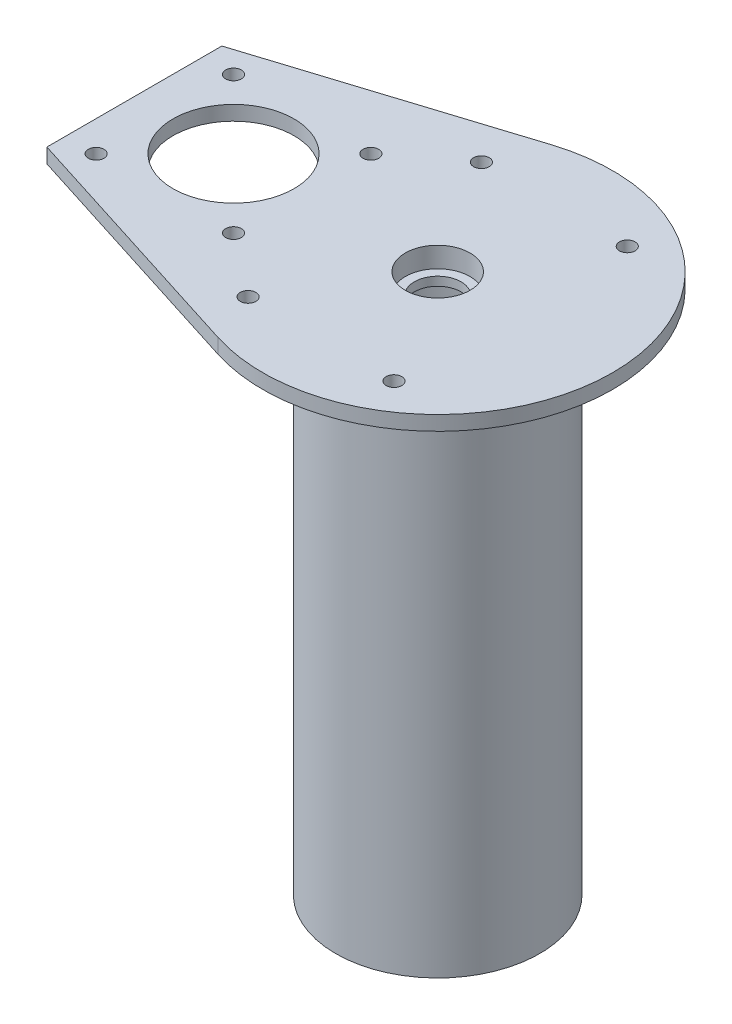
from build123d import *
from build123d.topology import SkipClean

# Parameters (mm, degrees)
SKETCH2_R           = 2.685
SKETCH2_R_2         = 11.1
SKETCH2_R_3         = 20.75
BOSS_EXTRUDE1_DEPTH = 5
SKETCH3_R           = 35
SKETCH3_R_2         = 30
BOSS_EXTRUDE2_DEPTH = 175
SKETCH4_R           = 35
BOSS_EXTRUDE3_DEPTH = 5
CUT_EXTRUDE3_START  = -6
CUT_EXTRUDE3_DEPTH  = 6
SKETCH10_R          = 16.1
BOSS_EXTRUDE5_DEPTH = 5
SKETCH5_R           = 11.1
CUT_EXTRUDE7_DEPTH  = 7
CUT_EXTRUDE8_REACH  = 216.709
SKETCH11_R          = 8
BOSS_EXTRUDE6_START = 2
SKETCH13_R          = 16.1
SKETCH13_R_2        = 11.1
BOSS_EXTRUDE6_DEPTH = 2
BOSS_EXTRUDE7_START = 3
SKETCH14_R          = 16.1
SKETCH14_R_2        = 8
BOSS_EXTRUDE7_DEPTH = 3
SKETCH15_R          = 2.685
CUT_EXTRUDE9_DEPTH  = 221.547047


with BuildPart() as part:
    # Sketch2 → Boss-Extrude1 (new body)
    with BuildSketch(Plane(origin=(0, 0, 0), x_dir=(1, 0, 0), z_dir=(0, 1, 0))):
        with BuildLine():
            Line((-104, -30), (-18.115404, -57.199931))
            ThreePointArc((-18.115404, -57.199931), (60, 0), (-18.115404, 57.199931))
            Line((-18.115404, 57.199931), (-104, 30))
            Line((-104, 30), (-104, -30))
        make_face()
        with Locations(Location((-93.55, 23.55, 0), (0, 0, 270))):
            Circle(SKETCH2_R, mode=Mode.SUBTRACT)
        with Locations(Location((-46.45, 23.55, 0), (0, 0, 270))):
            Circle(SKETCH2_R, mode=Mode.SUBTRACT)
        with Locations(Location((-93.55, -23.55, 0), (0, 0, 270))):
            Circle(SKETCH2_R, mode=Mode.SUBTRACT)
        with Locations(Location((-46.45, -23.55, 0), (0, 0, 270))):
            Circle(SKETCH2_R, mode=Mode.SUBTRACT)
        with Locations(Location((0, 0, 0), (0, 0, 270))):
            Circle(SKETCH2_R_2, mode=Mode.SUBTRACT)
        with Locations(Location((-70, 0, 0), (0, 0, 270))):
            Circle(SKETCH2_R_3, mode=Mode.SUBTRACT)
    extrude(amount=BOSS_EXTRUDE1_DEPTH)

    # Sketch3 → Boss-Extrude2 (add)
    with BuildSketch(Plane.XZ):
        with Locations(Location((0, 0, 0), (0, 0, 90))):
            Circle(SKETCH3_R)
        with Locations(Location((0, 0, 0), (0, 0, 270))):
            Circle(SKETCH3_R_2, mode=Mode.SUBTRACT)
    extrude(amount=BOSS_EXTRUDE2_DEPTH)

    # Sketch4 → Boss-Extrude3 (add)
    with BuildSketch(Plane.XZ.offset(175)):
        with Locations(Location((0, 0, 0), (0, 0, 90))):
            Circle(SKETCH4_R)
    extrude(amount=BOSS_EXTRUDE3_DEPTH)

    # Sketch6 → Cut-Extrude3 (cut)
    with SkipClean():  # the faces are left unmerged after this step: merging them gives an invalid solid
        with BuildSketch(Plane.XZ.offset(180).offset(CUT_EXTRUDE3_START)):
            with BuildLine():
                ThreePointArc((10, -17.320508), (20, 0), (10, 17.320508))
                ThreePointArc((10, 17.320508), (8.169873, 24.150635), (15, 25.980762))
                ThreePointArc((15, 25.980762), (30, 0), (15, -25.980762))
                ThreePointArc((15, -25.980762), (8.169873, -24.150635), (10, -17.320508))
            make_face()
        extrude(amount=CUT_EXTRUDE3_DEPTH, mode=Mode.SUBTRACT)

    # Sketch10 → Boss-Extrude5 (add)
    with SkipClean():  # the faces are left unmerged after this step: merging them gives an invalid solid
        with BuildSketch(Plane(origin=(0, -175, 0), x_dir=(1, 0, 0), z_dir=(0, 1, 0))):
            with Locations(Location((0, 0, 0), (0, 0, 90))):
                Circle(SKETCH10_R)
        extrude(amount=BOSS_EXTRUDE5_DEPTH)

    # Sketch5 → Cut-Extrude7 (cut)
    with SkipClean():  # the faces are left unmerged after this step: merging them gives an invalid solid
        with BuildSketch(Plane.XZ.offset(180)):
            with Locations(Location((0, 0, 0), (0, 0, 90))):
                Circle(SKETCH5_R)
        extrude(amount=-CUT_EXTRUDE7_DEPTH, mode=Mode.SUBTRACT)

    # Sketch11 → Cut-Extrude8 (cut, up to next)
    with BuildSketch(Plane.XZ.offset(173), mode=Mode.PRIVATE) as cut_extrude8_sk1:
        with Locations(Location((0, 0, 0), (0, 0, 270))):
            Circle(SKETCH11_R)
    cut_extrude8_tool1 = extrude(cut_extrude8_sk1.sketch, amount=-CUT_EXTRUDE8_REACH, mode=Mode.PRIVATE) & part.part
    add(cut_extrude8_tool1.solids().sort_by_distance((0, -173, 0))[0], mode=Mode.SUBTRACT)

    # Sketch13 → Boss-Extrude6 (add)
    with SkipClean():  # the faces are left unmerged after this step: merging them gives an invalid solid
        with BuildSketch(Plane.XZ.offset(BOSS_EXTRUDE6_START)):
            with Locations(Location((0, 0, 0), (0, 0, 270))):
                Circle(SKETCH13_R)
            with Locations(Location((0, 0, 0), (0, 0, 270))):
                Circle(SKETCH13_R_2, mode=Mode.SUBTRACT)
        extrude(amount=-BOSS_EXTRUDE6_DEPTH)

    # Sketch14 → Boss-Extrude7 (add)
    with SkipClean():  # the faces are left unmerged after this step: merging them gives an invalid solid
        with BuildSketch(Plane.XZ.offset(2).offset(BOSS_EXTRUDE7_START)):
            with Locations(Location((0, 0, 0), (0, 0, 270))):
                Circle(SKETCH14_R)
            with Locations(Location((0, 0, 0), (0, 0, 270))):
                Circle(SKETCH14_R_2, mode=Mode.SUBTRACT)
        extrude(amount=-BOSS_EXTRUDE7_DEPTH)

    # Sketch15 → Cut-Extrude9 (cut, through all)
    with SkipClean():  # the faces are left unmerged after this step: merging them gives an invalid solid
        with BuildSketch(Plane(origin=(0, 5, 0), x_dir=(1, 0, 0), z_dir=(0, 1, 0))):
            with Locations(Location((-25, 40, 0), (0, 0, 270))):
                Circle(SKETCH15_R)
            with Locations(Location((25, 40, 0), (0, 0, 270))):
                Circle(SKETCH15_R)
            with Locations(Location((25, -40, 0), (0, 0, 270))):
                Circle(SKETCH15_R)
            with Locations(Location((-25, -40, 0), (0, 0, 270))):
                Circle(SKETCH15_R)
        extrude(amount=-CUT_EXTRUDE9_DEPTH, mode=Mode.SUBTRACT)


solid = part.part
